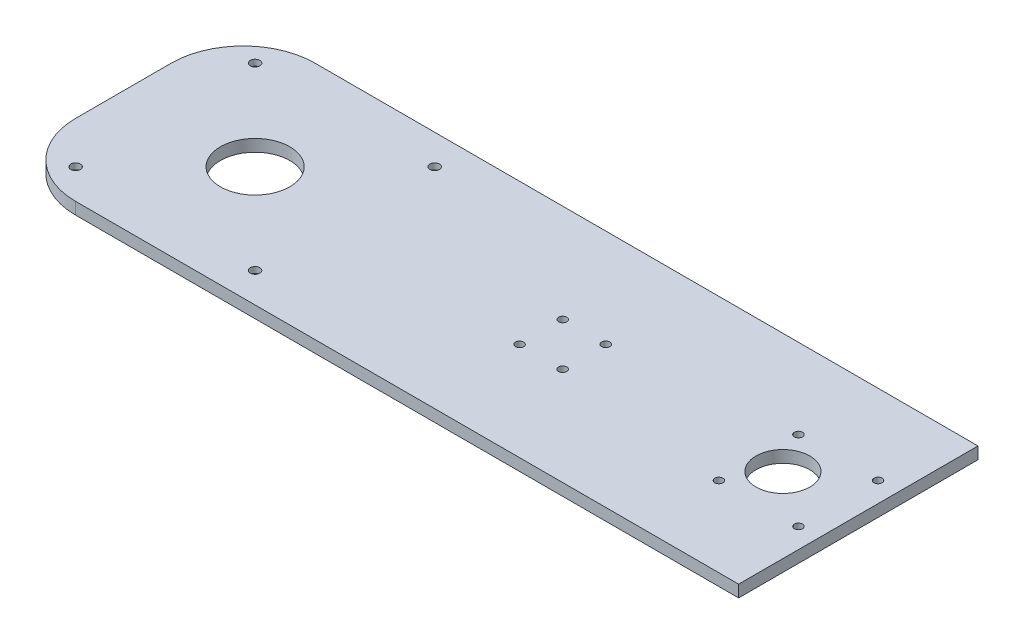
from build123d import *

# Parameters (mm, degrees)
SKETCH1_W             = 614
SKETCH1_H             = 200
EXTRUDE1_DEPTH        = 10
SKETCH2_R             = 29
SKETCH2_R_2           = 4
EXTRUDE2_DEPTH        = 10
M8_TAPPED_HOLE2_D     = 6.8
M8_TAPPED_HOLE2_DEPTH = 19.75
M8_TAPPED_HOLE2_TIP   = 2.042926105
SKETCH6_R             = 22.5
EXTRUDE3_DEPTH        = 10
SKETCH7_R             = 9
EXTRUDE4_DEPTH        = 5
LPATTERN1_COUNT       = 2
LPATTERN1_PITCH       = 150
LPATTERN1_COUNT_DIR2  = 2
LPATTERN1_PITCH_DIR2  = 150
M8_TAPPED_HOLE3_D     = 6.8
M8_TAPPED_HOLE3_DEPTH = 19.75
M8_TAPPED_HOLE3_TIP   = 2.042926105
FILLET1_R             = 60


with BuildPart() as part:
    # Sketch1 → Extrude1 (new body)
    with BuildSketch(Plane(origin=(0, 0, 0), x_dir=(1, 0, 0), z_dir=(0, 1, 0))):
        Rectangle(SKETCH1_W, SKETCH1_H)
    extrude(amount=EXTRUDE1_DEPTH)

    # Sketch2 → Extrude2 (cut)
    with BuildSketch(Plane(origin=(0, 10, 0), x_dir=(1, 0, 0), z_dir=(0, 1, 0))):
        with Locations(Location((-197, 0, 0), (0, 0, 270))):
            Circle(SKETCH2_R)
        with Locations(Location((-272, 75, 0), (0, 0, 270))):
            Circle(SKETCH2_R_2)
        with Locations(Location((-122, 75, 0), (0, 0, 90))):
            Circle(SKETCH2_R_2)
        with Locations(Location((-122, -75, 0), (0, 0, 270))):
            Circle(SKETCH2_R_2)
        with Locations(Location((-272, -75, 0), (0, 0, 90))):
            Circle(SKETCH2_R_2)
    extrude(amount=-EXTRUDE2_DEPTH, mode=Mode.SUBTRACT)

    # M8 Tapped Hole2
    with Locations(Plane(origin=(223.765981284, 10, -33.234018716), x_dir=(0, 0, 1), z_dir=(0, 1, 0))):
        with Locations((0, 0), (0, 66.468037432), (66.468037432, 0), (66.468037432, 66.468037432)):
            Hole(M8_TAPPED_HOLE2_D / 2, depth=M8_TAPPED_HOLE2_DEPTH)
            with Locations((0, 0, -(M8_TAPPED_HOLE2_DEPTH + M8_TAPPED_HOLE2_TIP / 2))):  # 118° drill point
                Cone(0, M8_TAPPED_HOLE2_D / 2, M8_TAPPED_HOLE2_TIP, mode=Mode.SUBTRACT)

    # Sketch6 → Extrude3 (cut)
    with BuildSketch(Plane(origin=(0, 10, 0), x_dir=(1, 0, 0), z_dir=(0, 1, 0))):
        with Locations(Location((244, 0, 0), (0, 0, 270))):
            Circle(SKETCH6_R)
    extrude(amount=-EXTRUDE3_DEPTH, mode=Mode.SUBTRACT)

    # Sketch7 → Extrude4 (cut)
    with BuildSketch(Plane.XZ):
        with Locations(Location((-272, 75, 0), (0, 0, 270))):
            Circle(SKETCH7_R)
    extrude4 = extrude(amount=-EXTRUDE4_DEPTH, mode=Mode.SUBTRACT)

    # LPattern1: Extrude4 2 × 2
    with Locations(*[(i * LPATTERN1_PITCH, 0, -j * LPATTERN1_PITCH_DIR2) for i in range(LPATTERN1_COUNT) for j in range(LPATTERN1_COUNT_DIR2) if (i, j) != (0, 0)]):
        add(extrude4, mode=Mode.SUBTRACT)

    # M8 Tapped Hole3
    with Locations(Plane(origin=(42, 10, -18), x_dir=(0, 0, 1), z_dir=(0, 1, 0))):
        with Locations((0, 0), (0, 36), (36, 0), (36, 36)):
            Hole(M8_TAPPED_HOLE3_D / 2, depth=M8_TAPPED_HOLE3_DEPTH)
            with Locations((0, 0, -(M8_TAPPED_HOLE3_DEPTH + M8_TAPPED_HOLE3_TIP / 2))):  # 118° drill point
                Cone(0, M8_TAPPED_HOLE3_D / 2, M8_TAPPED_HOLE3_TIP, mode=Mode.SUBTRACT)

    # Fillet1
    fillet1_edges = [part.edges().sort_by_distance(p)[0] for p in [
        (-307, 5, -100),
        (-307, 5, 100),
    ]]
    fillet(fillet1_edges, radius=FILLET1_R)


solid = part.part
